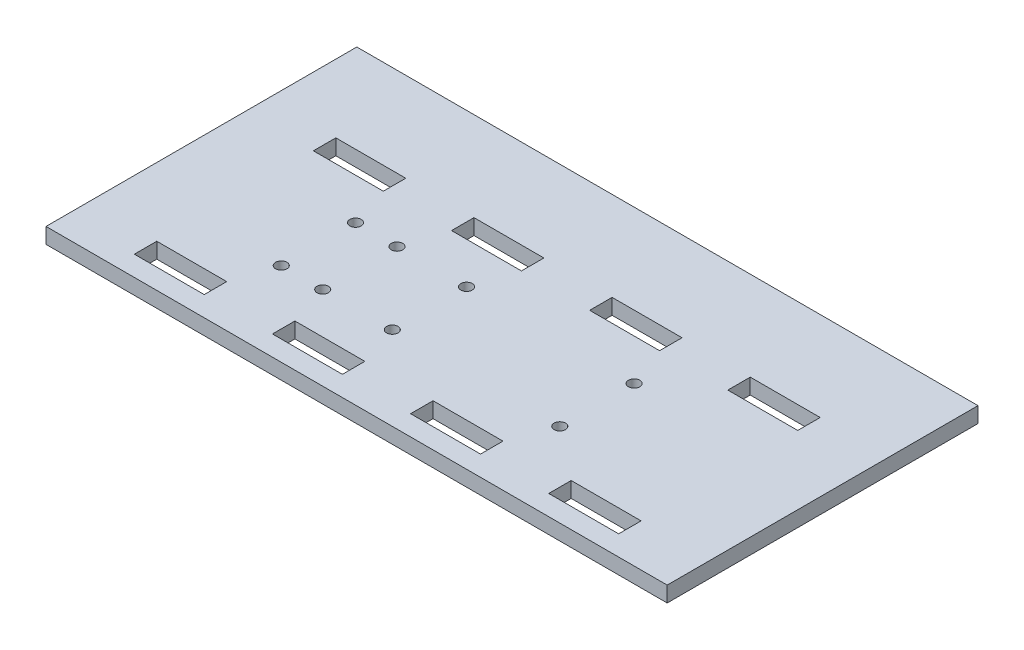
from build123d import *

# Parameters (mm, degrees)
SKETCH2_W           = 220
SKETCH2_H           = 90
BOSS_EXTRUDE1_DEPTH = 4.5
SKETCH3_W           = 20.25
SKETCH3_H           = 6.5
CUT_EXTRUDE1_DEPTH  = 119.933805119
SKETCH5_R           = 1.65
BRACKET_HOLES_DEPTH = 119.933805119
SKETCH6_W           = 59.428711229
SKETCH6_H           = 112.188854202
TRIM_CUT_DEPTH      = 119.933805119


with BuildPart() as part:
    # Sketch2 → Boss-Extrude1 (new body)
    with BuildSketch(Plane(origin=(0, 0, 0), x_dir=(1, 0, 0), z_dir=(0, 1, 0))):
        Rectangle(SKETCH2_W, SKETCH2_H)
    extrude(amount=BOSS_EXTRUDE1_DEPTH)

    # Sketch3 → Cut-Extrude1 (cut, through all)
    with BuildSketch(Plane.XZ):
        with Locations((40, -15.925)):
            Rectangle(SKETCH3_W, SKETCH3_H)
        with Locations((0, -15.925)):
            Rectangle(SKETCH3_W, SKETCH3_H)
        with Locations((80, -15.925)):
            Rectangle(SKETCH3_W, SKETCH3_H)
        with Locations((-80, -15.925)):
            Rectangle(SKETCH3_W, SKETCH3_H)
        with Locations((-40, -15.925)):
            Rectangle(SKETCH3_W, SKETCH3_H)
        with Locations((-40, 35.925)):
            Rectangle(SKETCH3_W, SKETCH3_H)
        with Locations((-80, 35.925)):
            Rectangle(SKETCH3_W, SKETCH3_H)
        with Locations((80, 35.925)):
            Rectangle(SKETCH3_W, SKETCH3_H)
        with Locations((40, 35.925)):
            Rectangle(SKETCH3_W, SKETCH3_H)
        with Locations((0, 35.925)):
            Rectangle(SKETCH3_W, SKETCH3_H)
    extrude(amount=-CUT_EXTRUDE1_DEPTH, mode=Mode.SUBTRACT)

    # Sketch5 → Bracket holes (cut, through all)
    with BuildSketch(Plane.XZ):
        with Locations(Location((-26, 20.75, 0), (0, 0, 270))):
            Circle(SKETCH5_R)
        with Locations(Location((-14, 20.75, 0), (0, 0, 270))):
            Circle(SKETCH5_R)
        with Locations(Location((6.15, 20.75, 0), (0, 0, 270))):
            Circle(SKETCH5_R)
        with Locations(Location((54.65, 20.75, 0), (0, 0, 270))):
            Circle(SKETCH5_R)
        with Locations(Location((54.65, -0.75, 0), (0, 0, 90))):
            Circle(SKETCH5_R)
        with Locations(Location((6.15, -0.75, 0), (0, 0, 90))):
            Circle(SKETCH5_R)
        with Locations(Location((-14, -0.75, 0), (0, 0, 90))):
            Circle(SKETCH5_R)
        with Locations(Location((-26, -0.75, 0), (0, 0, 90))):
            Circle(SKETCH5_R)
    extrude(amount=-BRACKET_HOLES_DEPTH, mode=Mode.SUBTRACT)

    # Sketch6 → Trim cut (cut, through all)
    with BuildSketch(Plane.XZ):
        with Locations((-99.589355615, -2.07728242)):
            Rectangle(SKETCH6_W, SKETCH6_H)
    extrude(amount=-TRIM_CUT_DEPTH, mode=Mode.SUBTRACT)


solid = part.part
